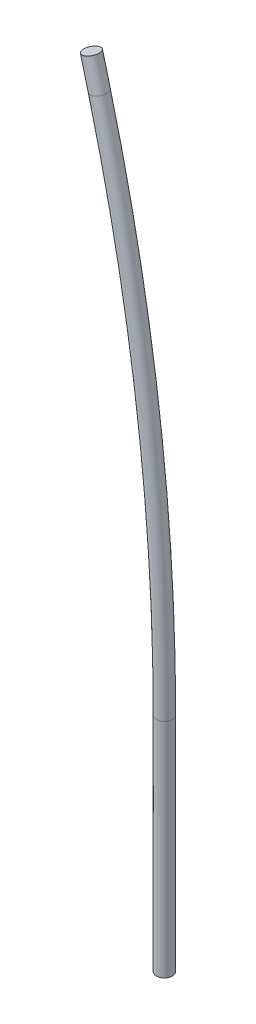
from build123d import *

# Parameters (mm, degrees)
SKETCH2_R           = 3.175
SKETCH4_R           = 3.175
BOSS_EXTRUDE1_DEPTH = 12.7
SKETCH5_R           = 3.175
BOSS_EXTRUDE2_DEPTH = 88.9


with BuildPart() as part:
    # Sweep1: sweep along a path in Sketch1
    with BuildLine(Plane.XY) as sweep1_path:
        ThreePointArc((41.275, 0), (34.739755092, 102.430538934), (15.24, 203.2))
    # Sketch2 → Sweep1 (sweep)
    with BuildSketch(Plane(origin=(0, 0, 0), x_dir=(1, 0, 0), z_dir=(0, 1, 0))):
        with Locations((41.275, 0)):
            Circle(SKETCH2_R)
    sweep(path=sweep1_path.line)

    # Sketch4 → Boss-Extrude1 (add)
    with BuildSketch(Plane(origin=(-48.605579352, 186.566514737, 0), x_dir=(0.9676982350284877, 0.25211133636302385, 0), z_dir=(-0.25211133636302385, 0.9676982350284877, 0))):
        with Locations((65.976744651, 0)):
            Circle(SKETCH4_R)
    extrude(amount=BOSS_EXTRUDE1_DEPTH)

    # Sketch5 → Boss-Extrude2 (add)
    with BuildSketch(Plane.XZ):
        with Locations((41.275, 0)):
            Circle(SKETCH5_R)
    extrude(amount=BOSS_EXTRUDE2_DEPTH)


solid = part.part
